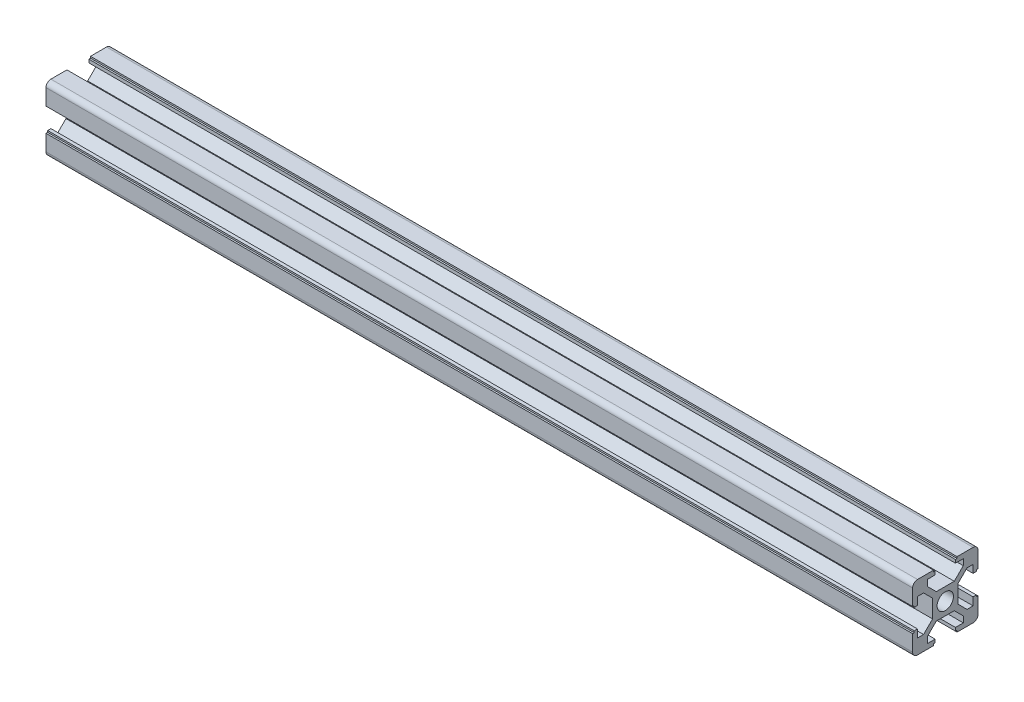
from build123d import *

# Parameters (mm, degrees)
SKETCH1_R                = 2.5
F_20_X_20_X_R1_5_1_DEPTH = 265


with BuildPart() as part:
    # Sketch1 → 铝型材 20 X 20 X R1.5(1) (new body)
    with BuildSketch(Plane(origin=(0, 0, 0), x_dir=(0, 0, -1), z_dir=(1, 0, 0))):
        with BuildLine():
            Line((-3.6, 10), (-3.6, 9.5))
            Line((-3.6, 9.5), (-3.1, 9.5))
            Line((-3.1, 9.5), (-3.1, 8.5))
            Line((-3.1, 8.5), (-5.5, 8.5))
            Line((-5.5, 8.5), (-5.5, 6.65))
            Line((-5.5, 6.65), (-2.75, 3.9))
            Line((-2.75, 3.9), (2.75, 3.9))
            Line((2.75, 3.9), (5.5, 6.65))
            Line((5.5, 6.65), (5.5, 8.5))
            Line((5.5, 8.5), (3.1, 8.5))
            Line((3.1, 8.5), (3.1, 9.5))
            Line((3.1, 9.5), (3.6, 9.5))
            Line((3.6, 9.5), (3.6, 10))
            Line((3.6, 10), (8.5, 10))
            ThreePointArc((8.5, 10), (9.560660172, 9.560660172), (10, 8.5))
            Line((10, 8.5), (10, 3.6))
            Line((10, 3.6), (9.5, 3.6))
            Line((9.5, 3.6), (9.5, 3.1))
            Line((9.5, 3.1), (8.5, 3.1))
            Line((8.5, 3.1), (8.5, 5.5))
            Line((8.5, 5.5), (6.65, 5.5))
            Line((6.65, 5.5), (3.9, 2.75))
            Line((3.9, 2.75), (3.9, -2.75))
            Line((3.9, -2.75), (6.65, -5.5))
            Line((6.65, -5.5), (8.5, -5.5))
            Line((8.5, -5.5), (8.5, -3.1))
            Line((8.5, -3.1), (9.5, -3.1))
            Line((9.5, -3.1), (9.5, -3.6))
            Line((9.5, -3.6), (10, -3.6))
            Line((10, -3.6), (10, -8.5))
            ThreePointArc((10, -8.5), (9.560660172, -9.560660172), (8.5, -10))
            Line((8.5, -10), (3.6, -10))
            Line((3.6, -10), (3.6, -9.5))
            Line((3.6, -9.5), (3.1, -9.5))
            Line((3.1, -9.5), (3.1, -8.5))
            Line((3.1, -8.5), (5.5, -8.5))
            Line((5.5, -8.5), (5.5, -6.65))
            Line((5.5, -6.65), (2.75, -3.9))
            Line((2.75, -3.9), (-2.75, -3.9))
            Line((-2.75, -3.9), (-5.5, -6.65))
            Line((-5.5, -6.65), (-5.5, -8.5))
            Line((-5.5, -8.5), (-3.1, -8.5))
            Line((-3.1, -8.5), (-3.1, -9.5))
            Line((-3.1, -9.5), (-3.6, -9.5))
            Line((-3.6, -9.5), (-3.6, -10))
            Line((-3.6, -10), (-8.5, -10))
            ThreePointArc((-8.5, -10), (-9.560660172, -9.560660172), (-10, -8.5))
            Line((-10, -8.5), (-10, -3.6))
            Line((-10, -3.6), (-9.5, -3.6))
            Line((-9.5, -3.6), (-9.5, -3.1))
            Line((-9.5, -3.1), (-8.5, -3.1))
            Line((-8.5, -3.1), (-8.5, -5.5))
            Line((-8.5, -5.5), (-6.65, -5.5))
            Line((-6.65, -5.5), (-3.9, -2.75))
            Line((-3.9, -2.75), (-3.9, 2.75))
            Line((-3.9, 2.75), (-6.65, 5.5))
            Line((-6.65, 5.5), (-8.5, 5.5))
            Line((-8.5, 5.5), (-8.5, 3.1))
            Line((-8.5, 3.1), (-9.5, 3.1))
            Line((-9.5, 3.1), (-9.5, 3.6))
            Line((-9.5, 3.6), (-10, 3.6))
            Line((-10, 3.6), (-10, 8.5))
            ThreePointArc((-10, 8.5), (-9.560660172, 9.560660172), (-8.5, 10))
            Line((-8.5, 10), (-3.6, 10))
        make_face()
        Circle(SKETCH1_R, mode=Mode.SUBTRACT)
    extrude(amount=F_20_X_20_X_R1_5_1_DEPTH)


solid = part.part
